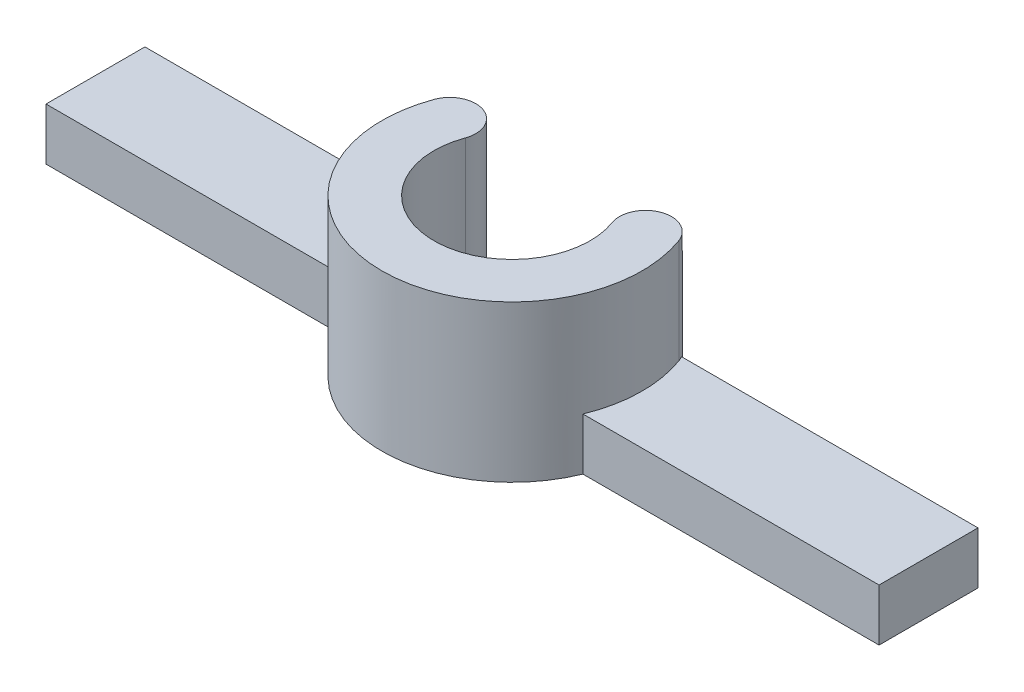
from build123d import *

# Parameters (mm, degrees)
BOSS_EXTRUDE1_DEPTH = 6
SKETCH2_W           = 11.5
SKETCH2_H           = 3.8
SKETCH2_H_2         = 1.9
BOSS_EXTRUDE2_DEPTH = 2


with BuildPart() as part:
    # Sketch1 → Boss-Extrude1 (new body)
    with BuildSketch(Plane(origin=(0, 0, 0), x_dir=(1, 0, 0), z_dir=(0, 1, 0))):
        with BuildLine():
            Line((5, 0), (3, 0))
            ThreePointArc((3, 0), (-0.520944533, -2.954423259), (-2.819077862, 1.02606043))
            ThreePointArc((-2.819077862, 1.02606043), (-3.41675034, 2.307773194), (-4.698463104, 1.710100717))
            ThreePointArc((-4.698463104, 1.710100717), (-0.868240888, -4.924038765), (5, 0))
        make_face()
        with BuildLine():
            ThreePointArc((2.819077862, 1.02606043), (2.954423259, 0.520944533), (3, 0))
            Line((3, 0), (5, 0))
            ThreePointArc((5, 0), (4.924038765, 0.868240888), (4.698463104, 1.710100717))
            Line((4.698463104, 1.710100717), (3.758770483, 1.368080573))
            Line((3.758770483, 1.368080573), (2.819077862, 1.02606043))
        make_face()
        with BuildLine():
            ThreePointArc((4.698463104, 1.710100717), (3.41675034, 2.307773194), (2.819077862, 1.02606043))
            Line((2.819077862, 1.02606043), (3.758770483, 1.368080573))
            Line((3.758770483, 1.368080573), (4.698463104, 1.710100717))
        make_face()
    extrude(amount=BOSS_EXTRUDE1_DEPTH)

    # Sketch2 → Boss-Extrude2 (add)
    with BuildSketch(Plane(origin=(0, 0, 0), x_dir=(1, 0, 0), z_dir=(0, 1, 0))):
        with Locations((-10.25, 0)):
            Rectangle(SKETCH2_W, SKETCH2_H)
        with Locations((10.25, -0.95)):
            Rectangle(SKETCH2_W, SKETCH2_H_2)
        with Locations((10.25, 0.95)):
            Rectangle(SKETCH2_W, SKETCH2_H_2)
    extrude(amount=BOSS_EXTRUDE2_DEPTH)


solid = part.part
